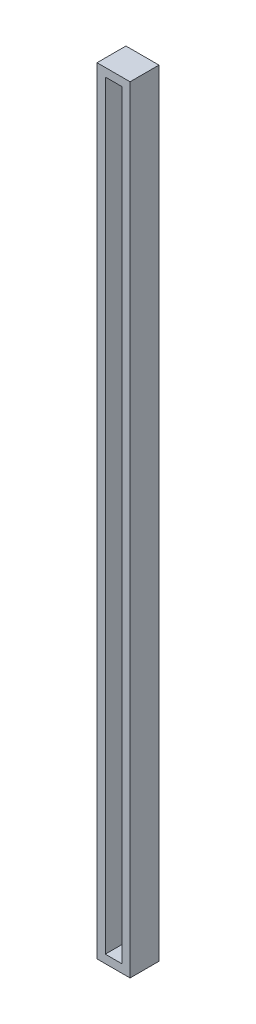
from build123d import *

# Parameters (mm, degrees)
SKETCH1_W     = 8
SKETCH1_H     = 188
SKETCH1_W_2   = 4
SKETCH1_H_2   = 184
PROFILE_DEPTH = 7


with BuildPart() as part:
    # Sketch1 → Profile (new body)
    with BuildSketch(Plane.XY):
        with Locations((4, 94)):
            Rectangle(SKETCH1_W, SKETCH1_H)
        with Locations((4, 94)):
            Rectangle(SKETCH1_W_2, SKETCH1_H_2, mode=Mode.SUBTRACT)
    extrude(amount=PROFILE_DEPTH)


solid = part.part
